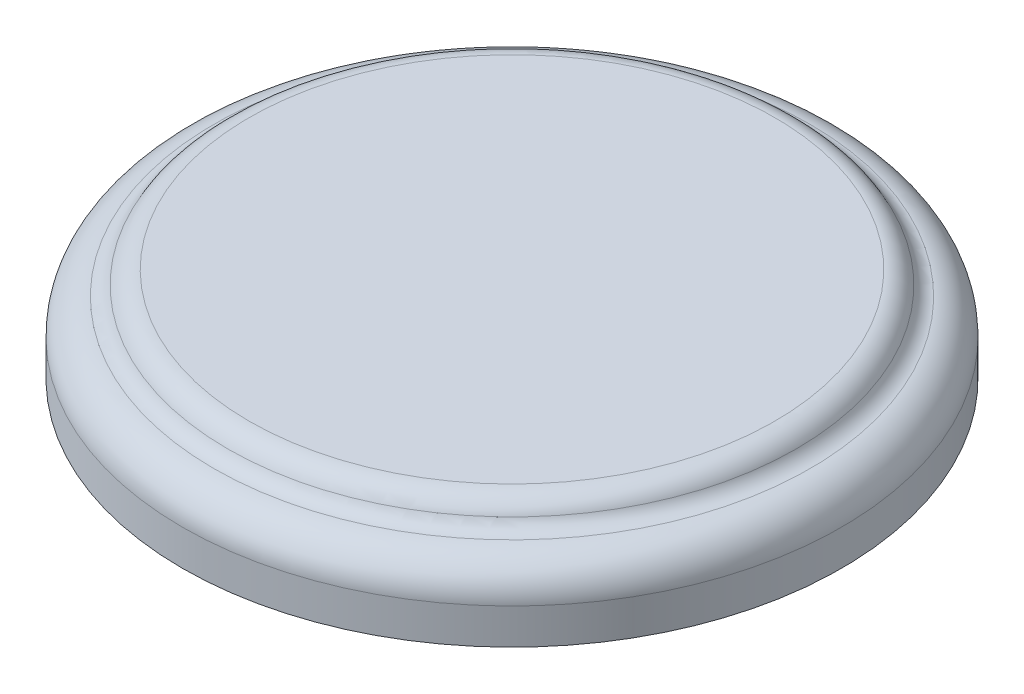
from build123d import *

# Parameters (mm, degrees)
FILLET1_R = 9.525
FILLET2_R = 19.05
FILLET3_R = 12.7
SHELL1_T  = -3.175


with BuildPart() as part:
    # Sketch1 → Revolve1 (revolve)
    with BuildSketch(Plane(origin=(0, 0, 0), x_dir=(0, 0, -1), z_dir=(1, 0, 0))):
        Polygon((0, 0), (-177.8, 0), (-177.8, 38.1), (-152.4, 38.1), (-152.4, 50.8), (0, 50.8), align=None)
    revolve(axis=Axis((0, 50.8, 0), (0, -1, 0)))

    # Fillet1
    fillet1_edges = [part.edges().sort_by_distance(p)[0] for p in [
        (0, 38.1, -152.4),
    ]]
    fillet(fillet1_edges, radius=FILLET1_R)

    # Fillet2
    fillet2_edges = [part.edges().sort_by_distance(p)[0] for p in [
        (0, 38.1, -177.8),
    ]]
    fillet(fillet2_edges, radius=FILLET2_R)

    # Fillet3
    fillet3_edges = [part.edges().sort_by_distance(p)[0] for p in [
        (0, 50.8, -152.4),
    ]]
    fillet(fillet3_edges, radius=FILLET3_R)

    # Shell1
    shell1_openings = [part.faces().sort_by_distance(p)[0] for p in [
        (0, 0, 0),
    ]]
    offset(amount=SHELL1_T, openings=shell1_openings, kind=Kind.INTERSECTION)


solid = part.part
